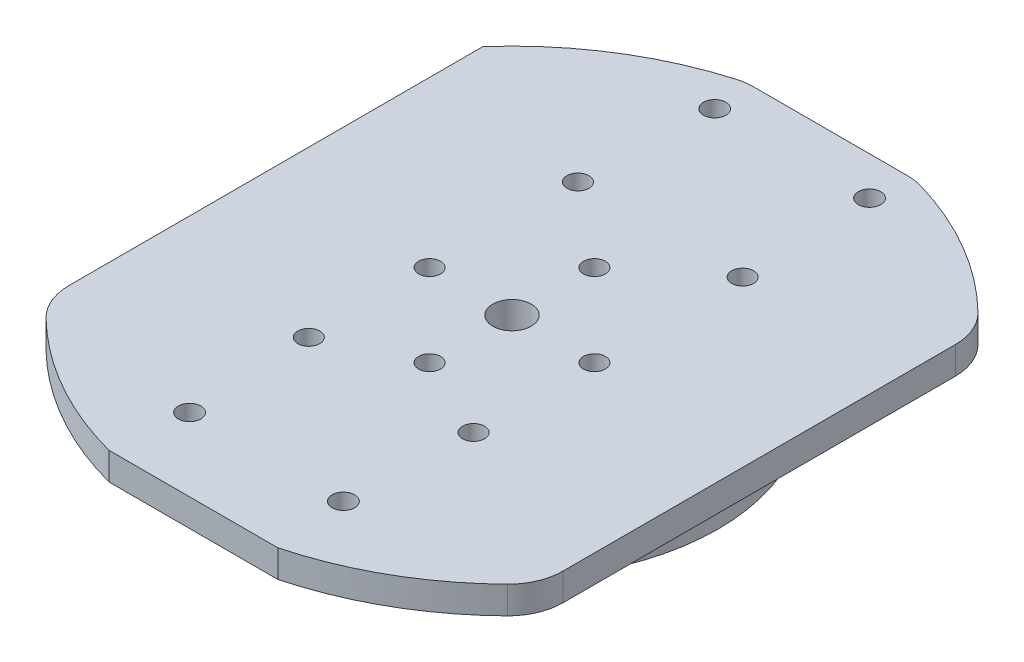
from build123d import *

# Parameters (mm, degrees)
SKETCH2_R                = 6.4
BOSS_EXTRUDE1_DEPTH      = 20
SKETCH3_R                = 8
BOSS_EXTRUDE2_DEPTH      = 1
SKETCH4_R                = 60
BOSS_EXTRUDE3_DEPTH      = 5
SKETCH5_R                = 2
CUT_EXTRUDE1_DEPTH       = 89.746830929
CIRPATTERN1_COUNT        = 4
CUT_EXTRUDE2_DEPTH       = 89.746830929
CUT_EXTRUDE2_DEPTH_BACK  = 89.746830929
SKETCH6_R                = 3.5
CUT_EXTRUDE3_DEPTH       = 89.746830929
CUT_EXTRUDE3_DEPTH_BACK  = 89.746830929
SKETCH7_R                = 2.05
CUT_EXTRUDE4_DEPTH       = 89.746830929
CUT_EXTRUDE6_DEPTH       = 88.407093534
CUT_EXTRUDE6_DEPTH_BACK  = 88.407093534
SKETCH10_R               = 1.5
CUT_EXTRUDE9_DEPTH       = 88.407093563
CUT_EXTRUDE9_DEPTH_BACK  = 4
SKETCH14_R               = 6.4
SKETCH14_R_2             = 3.5
SKETCH16_R               = 37.5
SKETCH16_R_2             = 35.05
BOSS_EXTRUDE4_DEPTH      = 10
SKETCH19_R               = 2
CUT_EXTRUDE10_DEPTH      = 5
SKETCH20_R               = 35.05
SKETCH20_R_2             = 33.05
BOSS_EXTRUDE5_DEPTH      = 2
SKETCH21_R               = 22.5
SKETCH21_R_2             = 19
BOSS_EXTRUDE6_DEPTH      = 2
CUT_EXTRUDE11_DEPTH      = 87.301796067
CUT_EXTRUDE11_DEPTH_BACK = 87.301796067
SKETCH22_OUTSIDE_W       = 155.668
SKETCH22_OUTSIDE_H       = 151.668
SKETCH22_OUTSIDE_W_2     = 90
SKETCH22_OUTSIDE_H_2     = 116
FILLET1_R                = 10


with BuildPart() as part:
    # Sketch2 → Boss-Extrude1 (new body)
    with BuildSketch(Plane(origin=(0, 0, 0), x_dir=(1, 0, 0), z_dir=(0, 1, 0))):
        with Locations(Location((0, 0, 0), (0, 0, 270))):
            Circle(SKETCH2_R)
    extrude(amount=BOSS_EXTRUDE1_DEPTH)

    # Sketch3 → Boss-Extrude2 (add)
    with BuildSketch(Plane(origin=(0, 20, 0), x_dir=(1, 0, 0), z_dir=(0, 1, 0))):
        with Locations(Location((0, 0, 0), (0, 0, 270))):
            Circle(SKETCH3_R)
    extrude(amount=BOSS_EXTRUDE2_DEPTH)

    # Sketch4 → Boss-Extrude3 (add)
    with BuildSketch(Plane(origin=(0, 21, 0), x_dir=(1, 0, 0), z_dir=(0, 1, 0))):
        with Locations(Location((0, 0, 0), (0, 0, 270))):
            Circle(SKETCH4_R)
    extrude(amount=BOSS_EXTRUDE3_DEPTH)

    # Sketch5 → Cut-Extrude1 (cut, symmetric)
    with BuildSketch(Plane(origin=(0, 26, 0), x_dir=(1, 0, 0), z_dir=(0, 1, 0))):
        with Locations(Location((0, 15, 0), (0, 0, 270))):
            Circle(SKETCH5_R)
    cut_extrude1 = extrude(amount=CUT_EXTRUDE1_DEPTH, both=True, mode=Mode.SUBTRACT)

    # CirPattern1: Cut-Extrude1 ×4 about axis
    cirpattern1_axis = Axis((0, 0, 0), (0, 1, 0))
    for i in range(1, CIRPATTERN1_COUNT):
        add(cut_extrude1.rotate(cirpattern1_axis, i * 360 / CIRPATTERN1_COUNT), mode=Mode.SUBTRACT)

    # Sketch6 → Cut-Extrude2 (cut, two sides: drawn at the far end of the back side and taken through both)
    with BuildSketch(Plane(origin=(0, 26, 0), x_dir=(1, 0, 0), z_dir=(0, 1, 0)).offset(-CUT_EXTRUDE2_DEPTH_BACK)):
        with Locations(Location((0, 0, 0), (0, 0, 270))):
            Circle(SKETCH6_R)
    extrude(amount=CUT_EXTRUDE2_DEPTH + CUT_EXTRUDE2_DEPTH_BACK, mode=Mode.SUBTRACT)

    # Sketch7 → Cut-Extrude3 (cut, two sides: drawn at the far end of the back side and taken through both)
    with BuildSketch(Plane(origin=(0, 26, 0), x_dir=(1, 0, 0), z_dir=(0, 1, 0)).offset(-CUT_EXTRUDE3_DEPTH_BACK)):
        with Locations(Location((-14, -44.7, 0), (0, 0, 270))):
            Circle(SKETCH7_R)
        with Locations(Location((14, -44.7, 0), (0, 0, 270))):
            Circle(SKETCH7_R)
        with Locations(Location((-14.1, 51, 0), (0, 0, 270))):
            Circle(SKETCH7_R)
        with Locations(Location((14.1, 51, 0), (0, 0, 270))):
            Circle(SKETCH7_R)
    extrude(amount=CUT_EXTRUDE3_DEPTH + CUT_EXTRUDE3_DEPTH_BACK, mode=Mode.SUBTRACT)

    # Sketch8 → Cut-Extrude4 (cut, symmetric)
    with BuildSketch(Plane(origin=(0, 26, 0), x_dir=(1, 0, 0), z_dir=(0, 1, 0))):
        with BuildLine():
            Line((-15.362291496, 58), (15.362291496, 58))
            ThreePointArc((15.362291496, 58), (0, 60), (-15.362291496, 58))
        make_face()
    cut_extrude4 = extrude(amount=CUT_EXTRUDE4_DEPTH, both=True, mode=Mode.SUBTRACT)

    # Mirror1: Cut-Extrude4 across plane
    add(cut_extrude4.mirror(Plane.XY), mode=Mode.SUBTRACT)

    # Sketch10 → Cut-Extrude6 (cut, two sides: drawn at the far end of the back side and taken through both)
    with BuildSketch(Plane(origin=(0, 0, 0), x_dir=(0, 0, -1), z_dir=(1, 0, 0)).offset(-CUT_EXTRUDE6_DEPTH_BACK)):
        with Locations((0, 8.5)):
            Circle(SKETCH10_R)
    extrude(amount=CUT_EXTRUDE6_DEPTH + CUT_EXTRUDE6_DEPTH_BACK, mode=Mode.SUBTRACT)

    # Sketch14 → Cut-Extrude9 (cut, two sides: drawn at the far end of the back side and taken through both)
    with BuildSketch(Plane.XZ.offset(-CUT_EXTRUDE9_DEPTH_BACK)):
        with Locations(Location((0, 0, 0), (0, 0, 270))):
            Circle(SKETCH14_R)
        with Locations(Location((0, 0, 0), (0, 0, 90))):
            Circle(SKETCH14_R_2, mode=Mode.SUBTRACT)
    extrude(amount=CUT_EXTRUDE9_DEPTH + CUT_EXTRUDE9_DEPTH_BACK, mode=Mode.SUBTRACT)

    # Sketch16 → Boss-Extrude4 (add)
    with BuildSketch(Plane.XZ.offset(-21)):
        with Locations(Location((0, 0, 0), (0, 0, 90))):
            Circle(SKETCH16_R)
        with Locations(Location((0, 0, 0), (0, 0, 270))):
            Circle(SKETCH16_R_2, mode=Mode.SUBTRACT)
    extrude(amount=BOSS_EXTRUDE4_DEPTH)

    # Sketch19 → Cut-Extrude10 (cut)
    with BuildSketch(Plane(origin=(0, 26, 0), x_dir=(1, 0, 0), z_dir=(0, 1, 0))):
        with Locations(Location((-15, 27, 0), (0, 0, 270))):
            Circle(SKETCH19_R)
        with Locations(Location((15, 27, 0), (0, 0, 270))):
            Circle(SKETCH19_R)
        with Locations(Location((15, -22, 0), (0, 0, 270))):
            Circle(SKETCH19_R)
        with Locations(Location((-15, -22, 0), (0, 0, 270))):
            Circle(SKETCH19_R)
    extrude(amount=-CUT_EXTRUDE10_DEPTH, mode=Mode.SUBTRACT)

    # Sketch20 → Boss-Extrude5 (add)
    with BuildSketch(Plane.XZ.offset(-21)):
        with Locations(Location((0, 0, 0), (0, 0, 270))):
            Circle(SKETCH20_R)
        with Locations(Location((0, 0, 0), (0, 0, 270))):
            Circle(SKETCH20_R_2, mode=Mode.SUBTRACT)
    extrude(amount=BOSS_EXTRUDE5_DEPTH)

    # Sketch21 → Boss-Extrude6 (add)
    with BuildSketch(Plane.XZ.offset(-21)):
        with Locations(Location((0, 0, 0), (0, 0, 90))):
            Circle(SKETCH21_R)
        with Locations(Location((0, 0, 0), (0, 0, 270))):
            Circle(SKETCH21_R_2, mode=Mode.SUBTRACT)
    extrude(amount=BOSS_EXTRUDE6_DEPTH)

    # Sketch22 outside → Cut-Extrude11 (cut, two sides: drawn at the far end of the back side and taken through both)
    with BuildSketch(Plane(origin=(0, 26, 0), x_dir=(1, 0, 0), z_dir=(0, 1, 0)).offset(-CUT_EXTRUDE11_DEPTH_BACK)):
        Rectangle(SKETCH22_OUTSIDE_W, SKETCH22_OUTSIDE_H)
        Rectangle(SKETCH22_OUTSIDE_W_2, SKETCH22_OUTSIDE_H_2, mode=Mode.SUBTRACT)
    extrude(amount=CUT_EXTRUDE11_DEPTH + CUT_EXTRUDE11_DEPTH_BACK, mode=Mode.SUBTRACT)

    # Fillet1
    fillet1_edges = [part.edges().sort_by_distance(p)[0] for p in [
        (45, 23.5, 39.686269666),
        (45, 23.5, -39.686269666),
        (-45, 23.5, 39.686269666),
        (-15.362291496, 23.5, -58),
        (15.362291496, 23.5, -58),
    ]]
    fillet(fillet1_edges, radius=FILLET1_R)


solid = part.part
